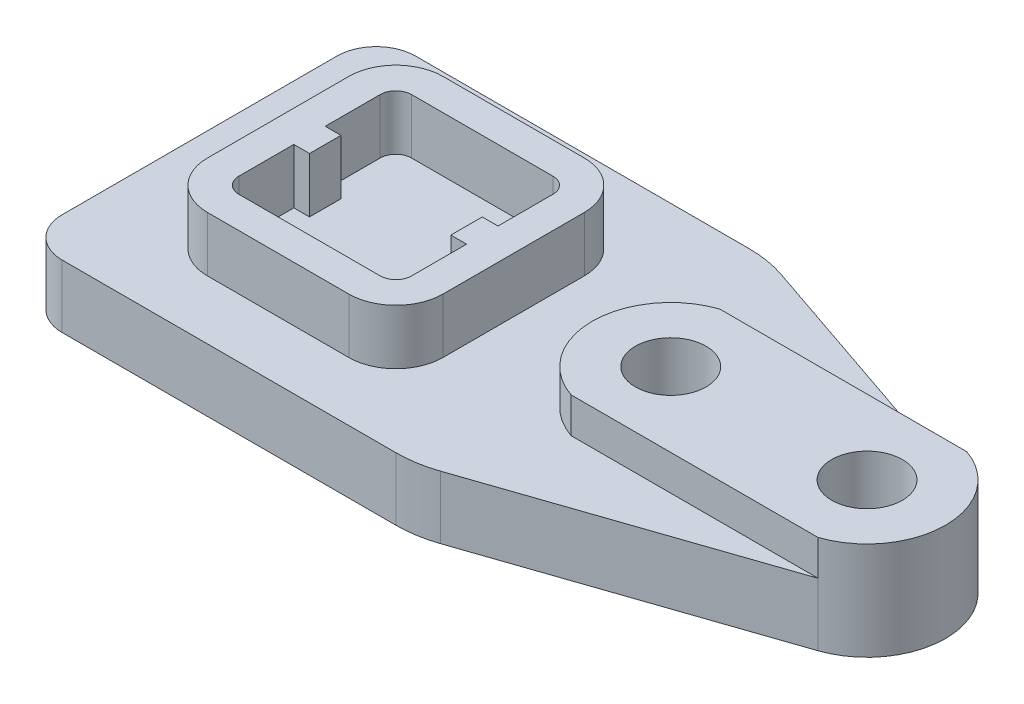
from build123d import *

# Parameters (mm, degrees)
EXTRUDE_1_DEPTH     = 16
FILLET_1_R          = 10
FILLET_2_R          = 30
EXTRUDE_2_DEPTH     = 14
SKETCH_5_R          = 9
EXTRUDE_3_DEPTH     = 9
SKETCH_7_R          = 9
CUT_EXTRUDE_2_DEPTH = 212.719153597


with BuildPart() as part:
    # 草图3 → 凸台-拉伸1 (new body)
    with BuildSketch(Plane(origin=(0, 0, 0), x_dir=(1, 0, 0), z_dir=(0, 1, 0))):
        with BuildLine():
            Line((0, 0), (0, 90))
            Line((0, 90), (100, 90))
            Line((100, 90), (176.45483392, 63.929741653))
            ThreePointArc((176.45483392, 63.929741653), (190, 45), (176.45483392, 26.070258347))
            Line((176.45483392, 26.070258347), (100, 0))
            Line((100, 0), (0, 0))
        make_face()
    extrude(amount=EXTRUDE_1_DEPTH)

    # 圆角1
    fillet_1_edges = [part.edges().sort_by_distance(p)[0] for p in [
        (0, 8, -90),
        (0, 8, 0),
    ]]
    fillet(fillet_1_edges, radius=FILLET_1_R)

    # 圆角2
    fillet_2_edges = [part.edges().sort_by_distance(p)[0] for p in [
        (100, 8, -90),
        (100, 8, 0),
    ]]
    fillet(fillet_2_edges, radius=FILLET_2_R)

    # 草图4 → 凸台-拉伸2 (add)
    with BuildSketch(Plane(origin=(0, 16, 0), x_dir=(1, 0, 0), z_dir=(0, 1, 0))):
        with BuildLine():
            Line((68, 75), (32, 75))
            ThreePointArc((32, 75), (23.514718626, 71.485281374), (20, 63))
            Line((20, 63), (20, 27))
            ThreePointArc((20, 27), (23.514718626, 18.514718626), (32, 15))
            Line((32, 15), (68, 15))
            ThreePointArc((68, 15), (76.485281374, 18.514718626), (80, 27))
            Line((80, 27), (80, 63))
            ThreePointArc((80, 63), (76.485281374, 71.485281374), (68, 75))
        make_face()
        with BuildLine():
            Line((28, 49), (28, 63))
            ThreePointArc((28, 63), (29.171572875, 65.828427125), (32, 67))
            Line((32, 67), (50, 67))
            Line((50, 67), (68, 67))
            ThreePointArc((68, 67), (70.828427125, 65.828427125), (72, 63))
            Line((72, 63), (72, 49))
            Line((72, 49), (68, 49))
            Line((68, 49), (68, 45))
            Line((68, 45), (68, 41))
            Line((68, 41), (72, 41))
            Line((72, 41), (72, 27))
            ThreePointArc((72, 27), (70.828427125, 24.171572875), (68, 23))
            Line((68, 23), (32, 23))
            ThreePointArc((32, 23), (29.171572875, 24.171572875), (28, 27))
            Line((28, 27), (28, 41))
            Line((28, 41), (32, 41))
            Line((32, 41), (32, 45))
            Line((32, 45), (32, 49))
            Line((32, 49), (28, 49))
        make_face(mode=Mode.SUBTRACT)
    extrude(amount=EXTRUDE_2_DEPTH)

    # 草图5 → 凸台-拉伸3 (add)
    with BuildSketch(Plane(origin=(0, 16, 0), x_dir=(1, 0, 0), z_dir=(0, 1, 0))):
        with BuildLine():
            Line((176.45483392, 63.929741653), (113.54516608, 63.929741653))
            ThreePointArc((113.54516608, 63.929741653), (100, 45), (113.54516608, 26.070258347))
            Line((113.54516608, 26.070258347), (176.45483392, 26.070258347))
            ThreePointArc((176.45483392, 26.070258347), (190, 45), (176.45483392, 63.929741653))
        make_face()
        with Locations((120, 45)):
            Circle(SKETCH_5_R, mode=Mode.SUBTRACT)
        with Locations((170, 45)):
            Circle(SKETCH_5_R, mode=Mode.SUBTRACT)
    extrude(amount=EXTRUDE_3_DEPTH)

    # 草图7 → 切除-拉伸2 (cut, through all)
    with BuildSketch(Plane(origin=(0, 25, 0), x_dir=(1, 0, 0), z_dir=(0, 1, 0))):
        with Locations((120, 45)):
            Circle(SKETCH_7_R)
        with Locations((170, 45)):
            Circle(SKETCH_7_R)
    extrude(amount=-CUT_EXTRUDE_2_DEPTH, mode=Mode.SUBTRACT)


solid = part.part
